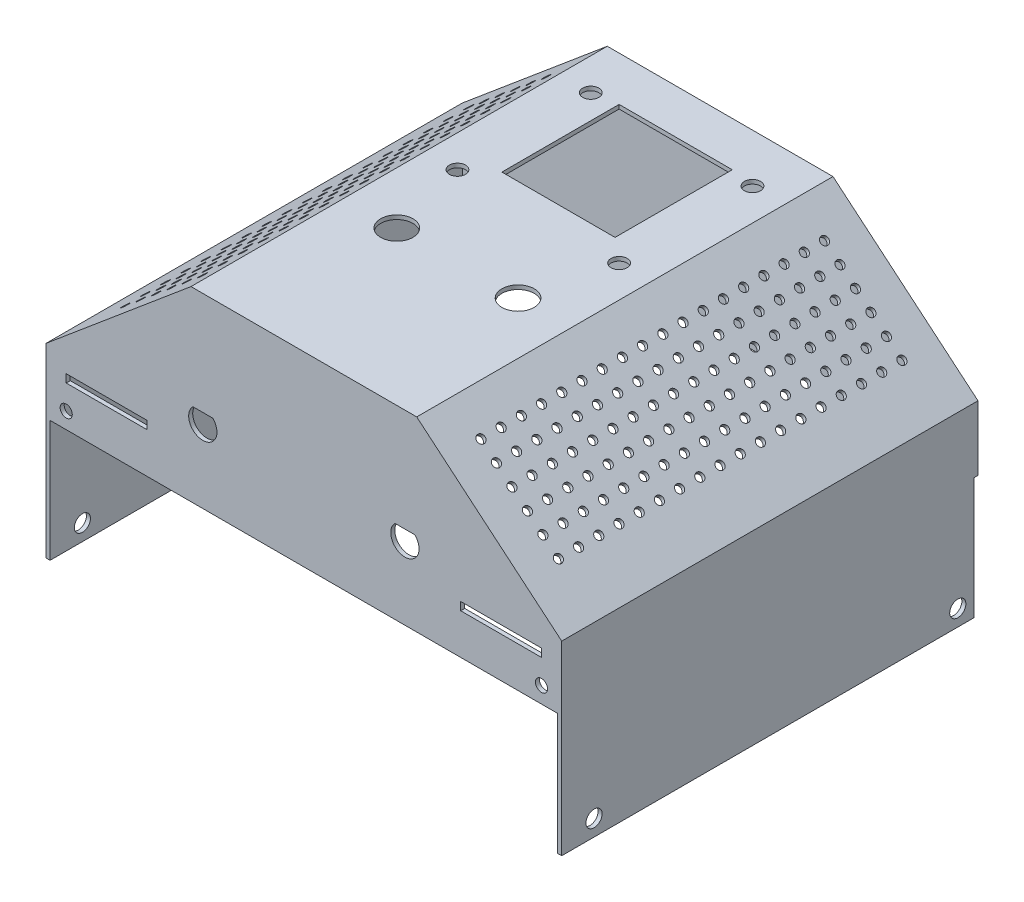
from build123d import *

# Parameters (mm, degrees)
EXTRUDE_1_DEPTH     = 102
CUT_EXTRUDE_1_REACH = 144.359
SKETCH_2_R          = 2
SKETCH_2_R_2        = 4
SKETCH_2_W          = 28
SKETCH_2_H          = 29
SKETCH_3_R          = 1
CUT_EXTRUDE_2_DEPTH = 1
SKETCH_4_R          = 1
CUT_EXTRUDE_3_DEPTH = 1
EXTRUDE_2_DEPTH     = 1
SKETCH_6_R          = 2
CUT_EXTRUDE_4_DEPTH = 181.214490514
SKETCH_7_R          = 1.5
SKETCH_7_W          = 20
SKETCH_7_H          = 2
EXTRUDE_3_DEPTH     = 1


with BuildPart() as part:
    # 草图1 → 凸台-拉伸1 (new body)
    with BuildSketch(Plane.XY):
        Polygon((0, 76.101922387), (27.925925851, 76.101922387), (63.8, 46), (63.8, 0), (62.8, 0), (62.8, 45.533692342), (27.561955617, 75.101922387), (0, 75.101922387), (-27.561955617, 75.101922387), (-62.8, 45.533692342), (-62.8, 0), (-63.8, 0), (-63.8, 46), (-27.925925851, 76.101922387), align=None)
    extrude(amount=EXTRUDE_1_DEPTH)

    # 草图2 → 切除-拉伸1 (cut, up to next)
    with BuildSketch(Plane(origin=(0, 76.101922387, 0), x_dir=(1, 0, 0), z_dir=(0, 1, 0)), mode=Mode.PRIVATE) as cut_extrude_1_sk1:
        with Locations(Location((-20, -11, 0), (0, 0, 270))):
            Circle(SKETCH_2_R)
    cut_extrude_1_tool1 = extrude(cut_extrude_1_sk1.sketch, amount=-CUT_EXTRUDE_1_REACH, mode=Mode.PRIVATE) & part.part
    # 草图2 → 切除-拉伸1 (cut, up to next)
    with BuildSketch(Plane(origin=(0, 76.101922387, 0), x_dir=(1, 0, 0), z_dir=(0, 1, 0)), mode=Mode.PRIVATE) as cut_extrude_1_sk2:
        with Locations(Location((20, -11, 0), (0, 0, 270))):
            Circle(SKETCH_2_R)
    cut_extrude_1_tool2 = extrude(cut_extrude_1_sk2.sketch, amount=-CUT_EXTRUDE_1_REACH, mode=Mode.PRIVATE) & part.part
    # 草图2 → 切除-拉伸1 (cut, up to next)
    with BuildSketch(Plane(origin=(0, 76.101922387, 0), x_dir=(1, 0, 0), z_dir=(0, 1, 0)), mode=Mode.PRIVATE) as cut_extrude_1_sk3:
        with Locations(Location((20, -44, 0), (0, 0, 270))):
            Circle(SKETCH_2_R)
    cut_extrude_1_tool3 = extrude(cut_extrude_1_sk3.sketch, amount=-CUT_EXTRUDE_1_REACH, mode=Mode.PRIVATE) & part.part
    # 草图2 → 切除-拉伸1 (cut, up to next)
    with BuildSketch(Plane(origin=(0, 76.101922387, 0), x_dir=(1, 0, 0), z_dir=(0, 1, 0)), mode=Mode.PRIVATE) as cut_extrude_1_sk4:
        with Locations(Location((-20, -44, 0), (0, 0, 270))):
            Circle(SKETCH_2_R)
    cut_extrude_1_tool4 = extrude(cut_extrude_1_sk4.sketch, amount=-CUT_EXTRUDE_1_REACH, mode=Mode.PRIVATE) & part.part
    # 草图2 → 切除-拉伸1 (cut, up to next)
    with BuildSketch(Plane(origin=(0, 76.101922387, 0), x_dir=(1, 0, 0), z_dir=(0, 1, 0)), mode=Mode.PRIVATE) as cut_extrude_1_sk5:
        with Locations(Location((15, -64, 0), (0, 0, 270))):
            Circle(SKETCH_2_R_2)
    cut_extrude_1_tool5 = extrude(cut_extrude_1_sk5.sketch, amount=-CUT_EXTRUDE_1_REACH, mode=Mode.PRIVATE) & part.part
    # 草图2 → 切除-拉伸1 (cut, up to next)
    with BuildSketch(Plane(origin=(0, 76.101922387, 0), x_dir=(1, 0, 0), z_dir=(0, 1, 0)), mode=Mode.PRIVATE) as cut_extrude_1_sk6:
        with Locations(Location((-15, -64, 0), (0, 0, 270))):
            Circle(SKETCH_2_R_2)
    cut_extrude_1_tool6 = extrude(cut_extrude_1_sk6.sketch, amount=-CUT_EXTRUDE_1_REACH, mode=Mode.PRIVATE) & part.part
    # 草图2 → 切除-拉伸1 (cut, up to next)
    with BuildSketch(Plane(origin=(0, 76.101922387, 0), x_dir=(1, 0, 0), z_dir=(0, 1, 0)), mode=Mode.PRIVATE) as cut_extrude_1_sk7:
        with Locations((0, -24.5)):
            Rectangle(SKETCH_2_W, SKETCH_2_H)
    cut_extrude_1_tool7 = extrude(cut_extrude_1_sk7.sketch, amount=-CUT_EXTRUDE_1_REACH, mode=Mode.PRIVATE) & part.part
    add(cut_extrude_1_tool1.solids().sort_by_distance((-20, 76.101922, 11))[0], mode=Mode.SUBTRACT)
    add(cut_extrude_1_tool2.solids().sort_by_distance((20, 76.101922, 11))[0], mode=Mode.SUBTRACT)
    add(cut_extrude_1_tool3.solids().sort_by_distance((20, 76.101922, 44))[0], mode=Mode.SUBTRACT)
    add(cut_extrude_1_tool4.solids().sort_by_distance((-20, 76.101922, 44))[0], mode=Mode.SUBTRACT)
    add(cut_extrude_1_tool5.solids().sort_by_distance((15, 76.101922, 64))[0], mode=Mode.SUBTRACT)
    add(cut_extrude_1_tool6.solids().sort_by_distance((-15, 76.101922, 64))[0], mode=Mode.SUBTRACT)
    add(cut_extrude_1_tool7.solids().sort_by_distance((0, 76.101922, 24.5))[0], mode=Mode.SUBTRACT)

    # 草图3 → 切除-拉伸2 (cut)
    with BuildSketch(Plane(origin=(-49.011201452, 58.409275407, 0), x_dir=(0.7660444431189801, 0.6427876096865369, 0), z_dir=(-0.6427876096865369, 0.7660444431189801, 0))):
        with Locations(Location((19.524872467, -8, 0), (0, 0, 180))):
            Circle(SKETCH_3_R)
        with Locations(Location((14.524872467, -8, 0), (0, 0, 180))):
            Circle(SKETCH_3_R)
        with Locations(Location((9.524872467, -8, 0), (0, 0, 180))):
            Circle(SKETCH_3_R)
        with Locations(Location((4.524872467, -8, 0), (0, 0, 180))):
            Circle(SKETCH_3_R)
        with Locations(Location((-0.475127533, -8, 0), (0, 0, 180))):
            Circle(SKETCH_3_R)
        with Locations(Location((-5.475127533, -8, 0), (0, 0, 180))):
            Circle(SKETCH_3_R)
        with Locations(Location((14.524872467, -13, 0), (0, 0, 180))):
            Circle(SKETCH_3_R)
        with Locations(Location((9.524872467, -13, 0), (0, 0, 180))):
            Circle(SKETCH_3_R)
        with Locations(Location((4.524872467, -13, 0), (0, 0, 180))):
            Circle(SKETCH_3_R)
        with Locations(Location((-0.475127533, -13, 0), (0, 0, 180))):
            Circle(SKETCH_3_R)
        with Locations(Location((-5.475127533, -13, 0), (0, 0, 180))):
            Circle(SKETCH_3_R)
        with Locations(Location((14.524872467, -18, 0), (0, 0, 180))):
            Circle(SKETCH_3_R)
        with Locations(Location((9.524872467, -18, 0), (0, 0, 180))):
            Circle(SKETCH_3_R)
        with Locations(Location((4.524872467, -18, 0), (0, 0, 180))):
            Circle(SKETCH_3_R)
        with Locations(Location((-0.475127533, -18, 0), (0, 0, 180))):
            Circle(SKETCH_3_R)
        with Locations(Location((-5.475127533, -18, 0), (0, 0, 180))):
            Circle(SKETCH_3_R)
        with Locations(Location((14.524872467, -23, 0), (0, 0, 180))):
            Circle(SKETCH_3_R)
        with Locations(Location((9.524872467, -23, 0), (0, 0, 180))):
            Circle(SKETCH_3_R)
        with Locations(Location((4.524872467, -23, 0), (0, 0, 180))):
            Circle(SKETCH_3_R)
        with Locations(Location((-0.475127533, -23, 0), (0, 0, 180))):
            Circle(SKETCH_3_R)
        with Locations(Location((-5.475127533, -23, 0), (0, 0, 180))):
            Circle(SKETCH_3_R)
        with Locations(Location((14.524872467, -28, 0), (0, 0, 180))):
            Circle(SKETCH_3_R)
        with Locations(Location((9.524872467, -28, 0), (0, 0, 180))):
            Circle(SKETCH_3_R)
        with Locations(Location((4.524872467, -28, 0), (0, 0, 180))):
            Circle(SKETCH_3_R)
        with Locations(Location((-0.475127533, -28, 0), (0, 0, 180))):
            Circle(SKETCH_3_R)
        with Locations(Location((-5.475127533, -28, 0), (0, 0, 180))):
            Circle(SKETCH_3_R)
        with Locations(Location((14.524872467, -33, 0), (0, 0, 180))):
            Circle(SKETCH_3_R)
        with Locations(Location((9.524872467, -33, 0), (0, 0, 180))):
            Circle(SKETCH_3_R)
        with Locations(Location((4.524872467, -33, 0), (0, 0, 180))):
            Circle(SKETCH_3_R)
        with Locations(Location((-0.475127533, -33, 0), (0, 0, 180))):
            Circle(SKETCH_3_R)
        with Locations(Location((-5.475127533, -33, 0), (0, 0, 180))):
            Circle(SKETCH_3_R)
        with Locations(Location((14.524872467, -38, 0), (0, 0, 180))):
            Circle(SKETCH_3_R)
        with Locations(Location((9.524872467, -38, 0), (0, 0, 180))):
            Circle(SKETCH_3_R)
        with Locations(Location((4.524872467, -38, 0), (0, 0, 180))):
            Circle(SKETCH_3_R)
        with Locations(Location((-0.475127533, -38, 0), (0, 0, 180))):
            Circle(SKETCH_3_R)
        with Locations(Location((-5.475127533, -38, 0), (0, 0, 180))):
            Circle(SKETCH_3_R)
        with Locations(Location((14.524872467, -43, 0), (0, 0, 180))):
            Circle(SKETCH_3_R)
        with Locations(Location((9.524872467, -43, 0), (0, 0, 180))):
            Circle(SKETCH_3_R)
        with Locations(Location((4.524872467, -43, 0), (0, 0, 180))):
            Circle(SKETCH_3_R)
        with Locations(Location((-0.475127533, -43, 0), (0, 0, 180))):
            Circle(SKETCH_3_R)
        with Locations(Location((-5.475127533, -43, 0), (0, 0, 180))):
            Circle(SKETCH_3_R)
        with Locations(Location((14.524872467, -48, 0), (0, 0, 180))):
            Circle(SKETCH_3_R)
        with Locations(Location((9.524872467, -48, 0), (0, 0, 180))):
            Circle(SKETCH_3_R)
        with Locations(Location((4.524872467, -48, 0), (0, 0, 180))):
            Circle(SKETCH_3_R)
        with Locations(Location((-0.475127533, -48, 0), (0, 0, 180))):
            Circle(SKETCH_3_R)
        with Locations(Location((-5.475127533, -48, 0), (0, 0, 180))):
            Circle(SKETCH_3_R)
        with Locations(Location((14.524872467, -53, 0), (0, 0, 180))):
            Circle(SKETCH_3_R)
        with Locations(Location((9.524872467, -53, 0), (0, 0, 180))):
            Circle(SKETCH_3_R)
        with Locations(Location((4.524872467, -53, 0), (0, 0, 180))):
            Circle(SKETCH_3_R)
        with Locations(Location((-0.475127533, -53, 0), (0, 0, 180))):
            Circle(SKETCH_3_R)
        with Locations(Location((-5.475127533, -53, 0), (0, 0, 180))):
            Circle(SKETCH_3_R)
        with Locations(Location((14.524872467, -58, 0), (0, 0, 180))):
            Circle(SKETCH_3_R)
        with Locations(Location((9.524872467, -58, 0), (0, 0, 180))):
            Circle(SKETCH_3_R)
        with Locations(Location((4.524872467, -58, 0), (0, 0, 180))):
            Circle(SKETCH_3_R)
        with Locations(Location((-0.475127533, -58, 0), (0, 0, 180))):
            Circle(SKETCH_3_R)
        with Locations(Location((-5.475127533, -58, 0), (0, 0, 180))):
            Circle(SKETCH_3_R)
        with Locations(Location((14.524872467, -63, 0), (0, 0, 180))):
            Circle(SKETCH_3_R)
        with Locations(Location((9.524872467, -63, 0), (0, 0, 180))):
            Circle(SKETCH_3_R)
        with Locations(Location((4.524872467, -63, 0), (0, 0, 180))):
            Circle(SKETCH_3_R)
        with Locations(Location((-0.475127533, -63, 0), (0, 0, 180))):
            Circle(SKETCH_3_R)
        with Locations(Location((-5.475127533, -63, 0), (0, 0, 180))):
            Circle(SKETCH_3_R)
        with Locations(Location((14.524872467, -68, 0), (0, 0, 180))):
            Circle(SKETCH_3_R)
        with Locations(Location((9.524872467, -68, 0), (0, 0, 180))):
            Circle(SKETCH_3_R)
        with Locations(Location((4.524872467, -68, 0), (0, 0, 180))):
            Circle(SKETCH_3_R)
        with Locations(Location((-0.475127533, -68, 0), (0, 0, 180))):
            Circle(SKETCH_3_R)
        with Locations(Location((-5.475127533, -68, 0), (0, 0, 180))):
            Circle(SKETCH_3_R)
        with Locations(Location((14.524872467, -73, 0), (0, 0, 180))):
            Circle(SKETCH_3_R)
        with Locations(Location((9.524872467, -73, 0), (0, 0, 180))):
            Circle(SKETCH_3_R)
        with Locations(Location((4.524872467, -73, 0), (0, 0, 180))):
            Circle(SKETCH_3_R)
        with Locations(Location((-0.475127533, -73, 0), (0, 0, 180))):
            Circle(SKETCH_3_R)
        with Locations(Location((-5.475127533, -73, 0), (0, 0, 180))):
            Circle(SKETCH_3_R)
        with Locations(Location((14.524872467, -78, 0), (0, 0, 180))):
            Circle(SKETCH_3_R)
        with Locations(Location((9.524872467, -78, 0), (0, 0, 180))):
            Circle(SKETCH_3_R)
        with Locations(Location((4.524872467, -78, 0), (0, 0, 180))):
            Circle(SKETCH_3_R)
        with Locations(Location((-0.475127533, -78, 0), (0, 0, 180))):
            Circle(SKETCH_3_R)
        with Locations(Location((-5.475127533, -78, 0), (0, 0, 180))):
            Circle(SKETCH_3_R)
        with Locations(Location((14.524872467, -83, 0), (0, 0, 180))):
            Circle(SKETCH_3_R)
        with Locations(Location((9.524872467, -83, 0), (0, 0, 180))):
            Circle(SKETCH_3_R)
        with Locations(Location((4.524872467, -83, 0), (0, 0, 180))):
            Circle(SKETCH_3_R)
        with Locations(Location((-0.475127533, -83, 0), (0, 0, 180))):
            Circle(SKETCH_3_R)
        with Locations(Location((-5.475127533, -83, 0), (0, 0, 180))):
            Circle(SKETCH_3_R)
        with Locations(Location((14.524872467, -88, 0), (0, 0, 180))):
            Circle(SKETCH_3_R)
        with Locations(Location((9.524872467, -88, 0), (0, 0, 180))):
            Circle(SKETCH_3_R)
        with Locations(Location((4.524872467, -88, 0), (0, 0, 180))):
            Circle(SKETCH_3_R)
        with Locations(Location((-0.475127533, -88, 0), (0, 0, 180))):
            Circle(SKETCH_3_R)
        with Locations(Location((-5.475127533, -88, 0), (0, 0, 180))):
            Circle(SKETCH_3_R)
        with Locations(Location((14.524872467, -93, 0), (0, 0, 180))):
            Circle(SKETCH_3_R)
        with Locations(Location((9.524872467, -93, 0), (0, 0, 180))):
            Circle(SKETCH_3_R)
        with Locations(Location((4.524872467, -93, 0), (0, 0, 180))):
            Circle(SKETCH_3_R)
        with Locations(Location((-0.475127533, -93, 0), (0, 0, 180))):
            Circle(SKETCH_3_R)
        with Locations(Location((-5.475127533, -93, 0), (0, 0, 180))):
            Circle(SKETCH_3_R)
        with Locations(Location((19.524872467, -13, 0), (0, 0, 180))):
            Circle(SKETCH_3_R)
        with Locations(Location((19.524872467, -18, 0), (0, 0, 180))):
            Circle(SKETCH_3_R)
        with Locations(Location((19.524872467, -23, 0), (0, 0, 180))):
            Circle(SKETCH_3_R)
        with Locations(Location((19.524872467, -28, 0), (0, 0, 180))):
            Circle(SKETCH_3_R)
        with Locations(Location((19.524872467, -33, 0), (0, 0, 180))):
            Circle(SKETCH_3_R)
        with Locations(Location((19.524872467, -38, 0), (0, 0, 180))):
            Circle(SKETCH_3_R)
        with Locations(Location((19.524872467, -43, 0), (0, 0, 180))):
            Circle(SKETCH_3_R)
        with Locations(Location((19.524872467, -48, 0), (0, 0, 180))):
            Circle(SKETCH_3_R)
        with Locations(Location((19.524872467, -53, 0), (0, 0, 180))):
            Circle(SKETCH_3_R)
        with Locations(Location((19.524872467, -58, 0), (0, 0, 180))):
            Circle(SKETCH_3_R)
        with Locations(Location((19.524872467, -63, 0), (0, 0, 180))):
            Circle(SKETCH_3_R)
        with Locations(Location((19.524872467, -68, 0), (0, 0, 180))):
            Circle(SKETCH_3_R)
        with Locations(Location((19.524872467, -73, 0), (0, 0, 180))):
            Circle(SKETCH_3_R)
        with Locations(Location((19.524872467, -78, 0), (0, 0, 180))):
            Circle(SKETCH_3_R)
        with Locations(Location((19.524872467, -83, 0), (0, 0, 180))):
            Circle(SKETCH_3_R)
        with Locations(Location((19.524872467, -88, 0), (0, 0, 180))):
            Circle(SKETCH_3_R)
        with Locations(Location((19.524872467, -93, 0), (0, 0, 180))):
            Circle(SKETCH_3_R)
    extrude(amount=-CUT_EXTRUDE_2_DEPTH, mode=Mode.SUBTRACT)

    # 草图4 → 切除-拉伸3 (cut)
    with BuildSketch(Plane(origin=(49.011201452, 58.409275407, 0), x_dir=(0.7660444431189801, -0.6427876096865369, 0), z_dir=(0.6427876096865369, 0.7660444431189801, 0))):
        with Locations(Location((-18.524872467, -8, 0), (0, 0, 180))):
            Circle(SKETCH_4_R)
        with Locations(Location((-13.524872467, -8, 0), (0, 0, 180))):
            Circle(SKETCH_4_R)
        with Locations(Location((-8.524872467, -8, 0), (0, 0, 180))):
            Circle(SKETCH_4_R)
        with Locations(Location((-3.524872467, -8, 0), (0, 0, 180))):
            Circle(SKETCH_4_R)
        with Locations(Location((1.475127533, -8, 0), (0, 0, 180))):
            Circle(SKETCH_4_R)
        with Locations(Location((6.475127533, -8, 0), (0, 0, 180))):
            Circle(SKETCH_4_R)
        with Locations(Location((-13.524872467, -13, 0), (0, 0, 180))):
            Circle(SKETCH_4_R)
        with Locations(Location((-8.524872467, -13, 0), (0, 0, 180))):
            Circle(SKETCH_4_R)
        with Locations(Location((-3.524872467, -13, 0), (0, 0, 180))):
            Circle(SKETCH_4_R)
        with Locations(Location((1.475127533, -13, 0), (0, 0, 180))):
            Circle(SKETCH_4_R)
        with Locations(Location((6.475127533, -13, 0), (0, 0, 180))):
            Circle(SKETCH_4_R)
        with Locations(Location((-13.524872467, -18, 0), (0, 0, 180))):
            Circle(SKETCH_4_R)
        with Locations(Location((-8.524872467, -18, 0), (0, 0, 180))):
            Circle(SKETCH_4_R)
        with Locations(Location((-3.524872467, -18, 0), (0, 0, 180))):
            Circle(SKETCH_4_R)
        with Locations(Location((1.475127533, -18, 0), (0, 0, 180))):
            Circle(SKETCH_4_R)
        with Locations(Location((6.475127533, -18, 0), (0, 0, 180))):
            Circle(SKETCH_4_R)
        with Locations(Location((-13.524872467, -23, 0), (0, 0, 180))):
            Circle(SKETCH_4_R)
        with Locations(Location((-8.524872467, -23, 0), (0, 0, 180))):
            Circle(SKETCH_4_R)
        with Locations(Location((-3.524872467, -23, 0), (0, 0, 180))):
            Circle(SKETCH_4_R)
        with Locations(Location((1.475127533, -23, 0), (0, 0, 180))):
            Circle(SKETCH_4_R)
        with Locations(Location((6.475127533, -23, 0), (0, 0, 180))):
            Circle(SKETCH_4_R)
        with Locations(Location((-13.524872467, -28, 0), (0, 0, 180))):
            Circle(SKETCH_4_R)
        with Locations(Location((-8.524872467, -28, 0), (0, 0, 180))):
            Circle(SKETCH_4_R)
        with Locations(Location((-3.524872467, -28, 0), (0, 0, 180))):
            Circle(SKETCH_4_R)
        with Locations(Location((1.475127533, -28, 0), (0, 0, 180))):
            Circle(SKETCH_4_R)
        with Locations(Location((6.475127533, -28, 0), (0, 0, 180))):
            Circle(SKETCH_4_R)
        with Locations(Location((-13.524872467, -33, 0), (0, 0, 180))):
            Circle(SKETCH_4_R)
        with Locations(Location((-8.524872467, -33, 0), (0, 0, 180))):
            Circle(SKETCH_4_R)
        with Locations(Location((-3.524872467, -33, 0), (0, 0, 180))):
            Circle(SKETCH_4_R)
        with Locations(Location((1.475127533, -33, 0), (0, 0, 180))):
            Circle(SKETCH_4_R)
        with Locations(Location((6.475127533, -33, 0), (0, 0, 180))):
            Circle(SKETCH_4_R)
        with Locations(Location((-13.524872467, -38, 0), (0, 0, 180))):
            Circle(SKETCH_4_R)
        with Locations(Location((-8.524872467, -38, 0), (0, 0, 180))):
            Circle(SKETCH_4_R)
        with Locations(Location((-3.524872467, -38, 0), (0, 0, 180))):
            Circle(SKETCH_4_R)
        with Locations(Location((1.475127533, -38, 0), (0, 0, 180))):
            Circle(SKETCH_4_R)
        with Locations(Location((6.475127533, -38, 0), (0, 0, 180))):
            Circle(SKETCH_4_R)
        with Locations(Location((-13.524872467, -43, 0), (0, 0, 180))):
            Circle(SKETCH_4_R)
        with Locations(Location((-8.524872467, -43, 0), (0, 0, 180))):
            Circle(SKETCH_4_R)
        with Locations(Location((-3.524872467, -43, 0), (0, 0, 180))):
            Circle(SKETCH_4_R)
        with Locations(Location((1.475127533, -43, 0), (0, 0, 180))):
            Circle(SKETCH_4_R)
        with Locations(Location((6.475127533, -43, 0), (0, 0, 180))):
            Circle(SKETCH_4_R)
        with Locations(Location((-13.524872467, -48, 0), (0, 0, 180))):
            Circle(SKETCH_4_R)
        with Locations(Location((-8.524872467, -48, 0), (0, 0, 180))):
            Circle(SKETCH_4_R)
        with Locations(Location((-3.524872467, -48, 0), (0, 0, 180))):
            Circle(SKETCH_4_R)
        with Locations(Location((1.475127533, -48, 0), (0, 0, 180))):
            Circle(SKETCH_4_R)
        with Locations(Location((6.475127533, -48, 0), (0, 0, 180))):
            Circle(SKETCH_4_R)
        with Locations(Location((-13.524872467, -53, 0), (0, 0, 180))):
            Circle(SKETCH_4_R)
        with Locations(Location((-8.524872467, -53, 0), (0, 0, 180))):
            Circle(SKETCH_4_R)
        with Locations(Location((-3.524872467, -53, 0), (0, 0, 180))):
            Circle(SKETCH_4_R)
        with Locations(Location((1.475127533, -53, 0), (0, 0, 180))):
            Circle(SKETCH_4_R)
        with Locations(Location((6.475127533, -53, 0), (0, 0, 180))):
            Circle(SKETCH_4_R)
        with Locations(Location((-13.524872467, -58, 0), (0, 0, 180))):
            Circle(SKETCH_4_R)
        with Locations(Location((-8.524872467, -58, 0), (0, 0, 180))):
            Circle(SKETCH_4_R)
        with Locations(Location((-3.524872467, -58, 0), (0, 0, 180))):
            Circle(SKETCH_4_R)
        with Locations(Location((1.475127533, -58, 0), (0, 0, 180))):
            Circle(SKETCH_4_R)
        with Locations(Location((6.475127533, -58, 0), (0, 0, 180))):
            Circle(SKETCH_4_R)
        with Locations(Location((-13.524872467, -63, 0), (0, 0, 180))):
            Circle(SKETCH_4_R)
        with Locations(Location((-8.524872467, -63, 0), (0, 0, 180))):
            Circle(SKETCH_4_R)
        with Locations(Location((-3.524872467, -63, 0), (0, 0, 180))):
            Circle(SKETCH_4_R)
        with Locations(Location((1.475127533, -63, 0), (0, 0, 180))):
            Circle(SKETCH_4_R)
        with Locations(Location((6.475127533, -63, 0), (0, 0, 180))):
            Circle(SKETCH_4_R)
        with Locations(Location((-13.524872467, -68, 0), (0, 0, 180))):
            Circle(SKETCH_4_R)
        with Locations(Location((-8.524872467, -68, 0), (0, 0, 180))):
            Circle(SKETCH_4_R)
        with Locations(Location((-3.524872467, -68, 0), (0, 0, 180))):
            Circle(SKETCH_4_R)
        with Locations(Location((1.475127533, -68, 0), (0, 0, 180))):
            Circle(SKETCH_4_R)
        with Locations(Location((6.475127533, -68, 0), (0, 0, 180))):
            Circle(SKETCH_4_R)
        with Locations(Location((-13.524872467, -73, 0), (0, 0, 180))):
            Circle(SKETCH_4_R)
        with Locations(Location((-8.524872467, -73, 0), (0, 0, 180))):
            Circle(SKETCH_4_R)
        with Locations(Location((-3.524872467, -73, 0), (0, 0, 180))):
            Circle(SKETCH_4_R)
        with Locations(Location((1.475127533, -73, 0), (0, 0, 180))):
            Circle(SKETCH_4_R)
        with Locations(Location((6.475127533, -73, 0), (0, 0, 180))):
            Circle(SKETCH_4_R)
        with Locations(Location((-13.524872467, -78, 0), (0, 0, 180))):
            Circle(SKETCH_4_R)
        with Locations(Location((-8.524872467, -78, 0), (0, 0, 180))):
            Circle(SKETCH_4_R)
        with Locations(Location((-3.524872467, -78, 0), (0, 0, 180))):
            Circle(SKETCH_4_R)
        with Locations(Location((1.475127533, -78, 0), (0, 0, 180))):
            Circle(SKETCH_4_R)
        with Locations(Location((6.475127533, -78, 0), (0, 0, 180))):
            Circle(SKETCH_4_R)
        with Locations(Location((-13.524872467, -83, 0), (0, 0, 180))):
            Circle(SKETCH_4_R)
        with Locations(Location((-8.524872467, -83, 0), (0, 0, 180))):
            Circle(SKETCH_4_R)
        with Locations(Location((-3.524872467, -83, 0), (0, 0, 180))):
            Circle(SKETCH_4_R)
        with Locations(Location((1.475127533, -83, 0), (0, 0, 180))):
            Circle(SKETCH_4_R)
        with Locations(Location((6.475127533, -83, 0), (0, 0, 180))):
            Circle(SKETCH_4_R)
        with Locations(Location((-13.524872467, -88, 0), (0, 0, 180))):
            Circle(SKETCH_4_R)
        with Locations(Location((-8.524872467, -88, 0), (0, 0, 180))):
            Circle(SKETCH_4_R)
        with Locations(Location((-3.524872467, -88, 0), (0, 0, 180))):
            Circle(SKETCH_4_R)
        with Locations(Location((1.475127533, -88, 0), (0, 0, 180))):
            Circle(SKETCH_4_R)
        with Locations(Location((6.475127533, -88, 0), (0, 0, 180))):
            Circle(SKETCH_4_R)
        with Locations(Location((-13.524872467, -93, 0), (0, 0, 180))):
            Circle(SKETCH_4_R)
        with Locations(Location((-8.524872467, -93, 0), (0, 0, 180))):
            Circle(SKETCH_4_R)
        with Locations(Location((-3.524872467, -93, 0), (0, 0, 180))):
            Circle(SKETCH_4_R)
        with Locations(Location((1.475127533, -93, 0), (0, 0, 180))):
            Circle(SKETCH_4_R)
        with Locations(Location((6.475127533, -93, 0), (0, 0, 180))):
            Circle(SKETCH_4_R)
        with Locations(Location((-18.524872467, -13, 0), (0, 0, 180))):
            Circle(SKETCH_4_R)
        with Locations(Location((-18.524872467, -18, 0), (0, 0, 180))):
            Circle(SKETCH_4_R)
        with Locations(Location((-18.524872467, -23, 0), (0, 0, 180))):
            Circle(SKETCH_4_R)
        with Locations(Location((-18.524872467, -28, 0), (0, 0, 180))):
            Circle(SKETCH_4_R)
        with Locations(Location((-18.524872467, -33, 0), (0, 0, 180))):
            Circle(SKETCH_4_R)
        with Locations(Location((-18.524872467, -38, 0), (0, 0, 180))):
            Circle(SKETCH_4_R)
        with Locations(Location((-18.524872467, -43, 0), (0, 0, 180))):
            Circle(SKETCH_4_R)
        with Locations(Location((-18.524872467, -48, 0), (0, 0, 180))):
            Circle(SKETCH_4_R)
        with Locations(Location((-18.524872467, -53, 0), (0, 0, 180))):
            Circle(SKETCH_4_R)
        with Locations(Location((-18.524872467, -58, 0), (0, 0, 180))):
            Circle(SKETCH_4_R)
        with Locations(Location((-18.524872467, -63, 0), (0, 0, 180))):
            Circle(SKETCH_4_R)
        with Locations(Location((-18.524872467, -68, 0), (0, 0, 180))):
            Circle(SKETCH_4_R)
        with Locations(Location((-18.524872467, -73, 0), (0, 0, 180))):
            Circle(SKETCH_4_R)
        with Locations(Location((-18.524872467, -78, 0), (0, 0, 180))):
            Circle(SKETCH_4_R)
        with Locations(Location((-18.524872467, -83, 0), (0, 0, 180))):
            Circle(SKETCH_4_R)
        with Locations(Location((-18.524872467, -88, 0), (0, 0, 180))):
            Circle(SKETCH_4_R)
        with Locations(Location((-18.524872467, -93, 0), (0, 0, 180))):
            Circle(SKETCH_4_R)
    extrude(amount=-CUT_EXTRUDE_3_DEPTH, mode=Mode.SUBTRACT)

    # 草图5 → 凸台-拉伸2 (add)
    with BuildSketch(Plane(origin=(0, 0, 0), x_dir=(-1, 0, 0), z_dir=(0, 0, -1))):
        Polygon((63.8, 46), (63.8, 30), (-63.8, 30), (-63.8, 46), (-27.925925851, 76.101922387), (27.925925851, 76.101922387), align=None)
    extrude(amount=EXTRUDE_2_DEPTH)

    # 草图6 → 切除-拉伸4 (cut, through all)
    with BuildSketch(Plane(origin=(63.8, 0, 0), x_dir=(0, 0, -1), z_dir=(1, 0, 0))):
        with Locations((-4, 4)):
            Circle(SKETCH_6_R)
        with Locations((-94, 4)):
            Circle(SKETCH_6_R)
    extrude(amount=-CUT_EXTRUDE_4_DEPTH, mode=Mode.SUBTRACT)

    # 草图7 → 凸台-拉伸3 (add)
    with BuildSketch(Plane.XY.offset(102)):
        Polygon((-27.925925851, 76.101922387), (-63.8, 46), (-63.8, 30), (63.8, 30), (63.8, 46), (27.925925851, 76.101922387), align=None)
        with Locations((58.8, 34)):
            Circle(SKETCH_7_R, mode=Mode.SUBTRACT)
        with Locations(Location((-58.8, 34, 0), (0, 0, 180))):
            Circle(SKETCH_7_R, mode=Mode.SUBTRACT)
        with BuildLine():
            Line((22.550510257, 50.601922387), (27.449489743, 50.601922387))
            ThreePointArc((27.449489743, 50.601922387), (25, 44.601922387), (22.550510257, 50.601922387))
        make_face(mode=Mode.SUBTRACT)
        with BuildLine():
            Line((-22.550510257, 50.601922387), (-27.449489743, 50.601922387))
            ThreePointArc((-27.449489743, 50.601922387), (-25, 44.601922387), (-22.550510257, 50.601922387))
        make_face(mode=Mode.SUBTRACT)
        with Locations((48.8, 41)):
            Rectangle(SKETCH_7_W, SKETCH_7_H, mode=Mode.SUBTRACT)
        with Locations((-48.8, 41)):
            Rectangle(SKETCH_7_W, SKETCH_7_H, mode=Mode.SUBTRACT)
    extrude(amount=-EXTRUDE_3_DEPTH)


solid = part.part
